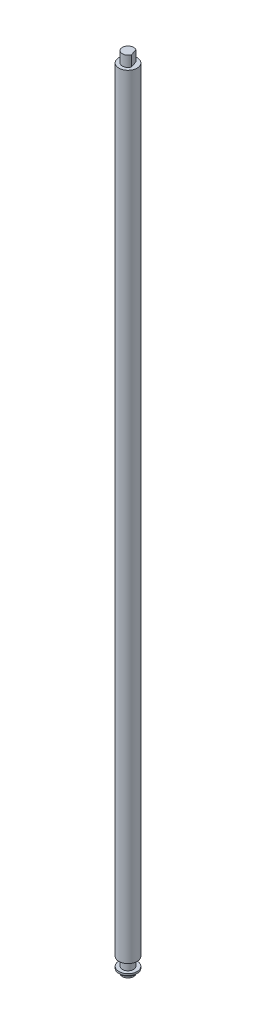
from build123d import *

# Parameters (mm, degrees)
CHANFREIN1_SIZE         = 0.8
ENL_V_MAT_EXTRU_1_DEPTH = 5.5


with BuildPart() as part:
    # Esquisse1 → Révolution1 (revolve)
    with BuildSketch(Plane.XY):
        Polygon((0, 0), (0, 413), (2.9, 413), (2.9, 407.5), (4.7, 407.5), (4.7, 7.7), (2.9, 7.7), (2.9, 3.2), (4.7, 3.2), (4.7, 1.5), (2.9, 1.5), (2.9, 0), align=None)
    revolve(axis=Axis((0, 0, 0), (0, 1, 0)))

    # Chanfrein1
    chanfrein1_edges = [part.edges().sort_by_distance(p)[0] for p in [
        (-4.7, 1.5, 0),
    ]]
    chamfer(chanfrein1_edges, length=CHANFREIN1_SIZE)

    # Esquisse2 → Enlèv. mat.-Extru.1 (cut)
    with BuildSketch(Plane(origin=(0, 413, 0), x_dir=(1, 0, 0), z_dir=(0, 1, 0))):
        Polygon((1.627133166, 2.400507792), (2.752297905, -0.91370468), (4.646133603, -0.2707534), (3.520968864, 3.043459072), align=None)
    extrude(amount=-ENL_V_MAT_EXTRU_1_DEPTH, mode=Mode.SUBTRACT)


solid = part.part
